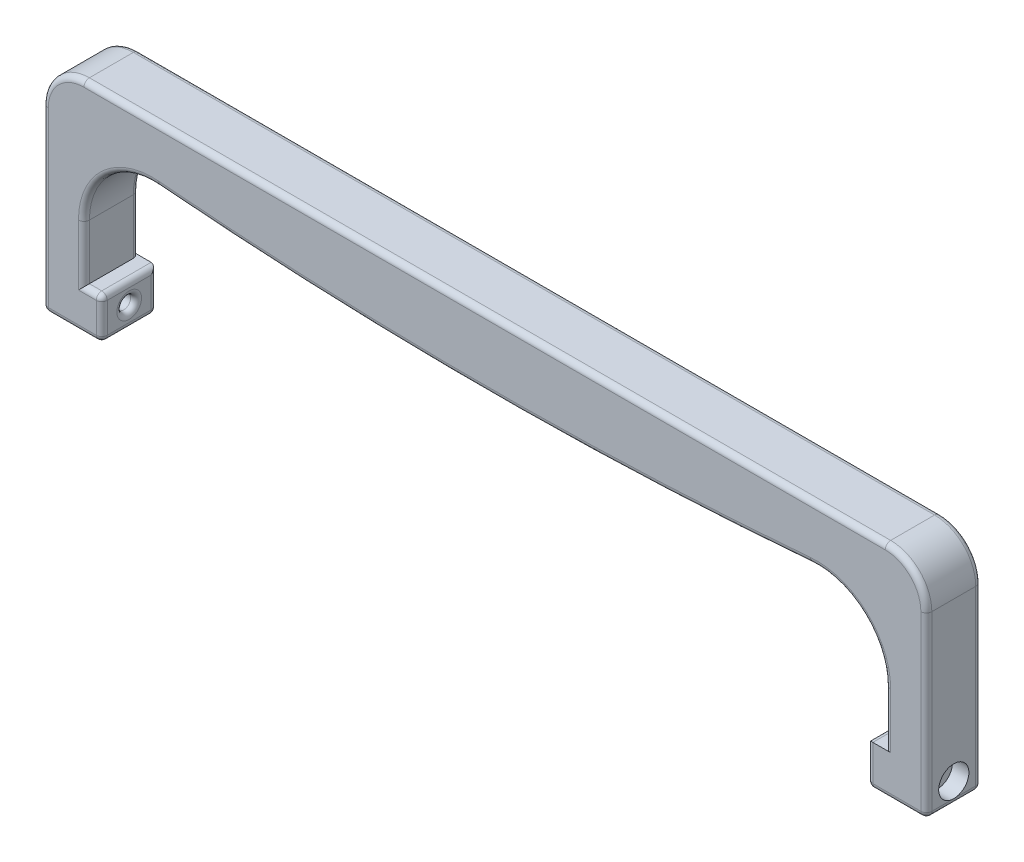
from build123d import *

# Parameters (mm, degrees)
BOSS_EXTRUDE1_DEPTH      = 20
FILLET7_R                = 15
CUT_EXTRUDE3_DEPTH       = 333.39133562714903
CUT_EXTRUDE3_DEPTH_BACK  = 333.39133562714903
SKETCH5_R                = 2.5
SKETCH6_R                = 5.5
CUT_EXTRUDE4_DEPTH       = 6
CUT_EXTRUDE5_START       = -6
SKETCH7_R                = 5.5
CUT_EXTRUDE5_DEPTH       = 6
FILLET2_R                = 2
FILLET3_R                = 2
BOSS_EXTRUDE2_DEPTH      = 1
BOSS_EXTRUDE2_DEPTH_BACK = 10


with BuildPart() as part:
    # Sketch1 → Boss-Extrude1 (new body)
    with BuildSketch(Plane.XY):
        with BuildLine():
            Line((-146.00000000000003, 15), (-146.00000000000003, 35.088261394563546))
            ThreePointArc((-146.00000000000003, 35.088261394563546), (-137.91933959730483, 53.49304195807679), (-118.90112419271411, 60))
            ThreePointArc((-118.90112419271411, 60), (8.672e-14, 55), (118.90112419271411, 60))
            ThreePointArc((118.90112419271411, 60), (137.91933959730483, 53.493041958076795), (146.00000000000003, 35.088261394563546))
            Line((146.00000000000003, 35.088261394563546), (146.00000000000003, 14.999999999999998))
            Line((146.00000000000003, 14.999999999999998), (139.49999999999997, 15))
            Line((139.49999999999997, 15), (139.49999999999997, -8e-16))
            Line((139.49999999999997, -8e-16), (146.00000000000003, -1.788e-14))
            Line((146.00000000000003, -1.788e-14), (161.00000000000003, -1.223e-14))
            Line((161.00000000000003, -1.223e-14), (161.00000000000003, 28.577779898868368))
            Line((161.00000000000003, 28.577779898868368), (161.00000000000003, 80.00000000000001))
            Line((161.00000000000003, 80.00000000000001), (84.84499999999998, 80.00000000000001))
            Line((84.84499999999998, 80.00000000000001), (-146.00000000000003, 79.99999999999997))
            Line((-146.00000000000003, 79.99999999999997), (-161.00000000000003, 79.99999999999997))
            Line((-161.00000000000003, 79.99999999999997), (-161.00000000000003, 28.577779898868233))
            Line((-161.00000000000003, 28.577779898868233), (-161.00000000000003, -1.223e-14))
            Line((-161.00000000000003, -1.223e-14), (-146.00000000000003, -1.788e-14))
            Line((-146.00000000000003, -1.788e-14), (-139.49999999999997, -8e-16))
            Line((-139.49999999999997, -8e-16), (-139.49999999999997, 15))
            Line((-139.49999999999997, 15), (-146.00000000000003, 15))
        make_face()
    extrude(amount=BOSS_EXTRUDE1_DEPTH)

    # Fillet7
    fillet7_edges = [part.edges().sort_by_distance(p)[0] for p in [
        (161.00000000000003, 80.00000000000001, 10),
        (-161.00000000000003, 79.99999999999997, 10),
    ]]
    fillet(fillet7_edges, radius=FILLET7_R)

    # Sketch5 → Cut-Extrude3 (cut, two sides: drawn at the far end of the back side and taken through both)
    with BuildSketch(Plane.ZY.offset(161.00000000000003).offset(-CUT_EXTRUDE3_DEPTH_BACK)):
        with Locations((10, 7.499999999999994)):
            Circle(SKETCH5_R)
    extrude(amount=CUT_EXTRUDE3_DEPTH + CUT_EXTRUDE3_DEPTH_BACK, mode=Mode.SUBTRACT)

    # Sketch6 → Cut-Extrude4 (cut)
    with BuildSketch(Plane.ZY.offset(161.00000000000003)):
        with Locations((10, 7.499999999999994)):
            Circle(SKETCH6_R)
    extrude(amount=-CUT_EXTRUDE4_DEPTH, mode=Mode.SUBTRACT)

    # Sketch7 → Cut-Extrude5 (cut)
    with BuildSketch(Plane(origin=(161.00000000000003, 0, 0), x_dir=(0, 0, -1), z_dir=(1, 0, 0)).offset(CUT_EXTRUDE5_START)):
        with Locations((-10, 7.499999999999994)):
            Circle(SKETCH7_R)
    extrude(amount=CUT_EXTRUDE5_DEPTH, mode=Mode.SUBTRACT)

    # Fillet2
    fillet2_edges = [part.edges().sort_by_distance(p)[0] for p in [
        (146.00000000000003, 25.044130697281773, 20),
        (137.91933959730483, 53.49304195807679, 20),
        (3.55e-15, 55, 20),
        (-137.91933959730483, 53.49304195807679, 20),
        (146.00000000000003, 25.044130697281773, 0),
        (137.91933959730483, 53.49304195807679, 0),
        (3.55e-15, 55, 0),
        (-137.91933959730483, 53.49304195807679, 0),
        (161.00000000000003, 32.5, 20),
        (161.00000000000003, 32.5, 0),
        (-146.00000000000003, 25.044130697281773, 20),
        (-146.00000000000003, 25.044130697281773, 0),
        (-161.00000000000003, 32.5, 0),
        (-161.00000000000003, 32.5, 20),
        (156.60660171779824, 75.60660171779823, 0),
        (0, 80, 0),
        (-156.60660171779824, 75.60660171779823, 0),
        (156.60660171779824, 75.60660171779823, 20),
        (0, 80, 20),
        (-156.60660171779824, 75.60660171779823, 20),
    ]]
    fillet(fillet2_edges, radius=FILLET2_R)

    # Fillet3
    fillet3_edges = [part.edges().sort_by_distance(p)[0] for p in [
        (149.25, -5.98e-15, 0),
        (160.41421356237313, -5.205e-14, 0.5857864376269046),
        (161.00000000000003, -1.223e-14, 10),
        (160.41421356237313, -4.263e-14, 19.414213562373096),
        (-149.25, -5.98e-15, 0),
        (-160.41421356237313, -1.421e-14, 0.5857864376269049),
        (-161.00000000000003, -1.223e-14, 10),
        (-160.41421356237313, -1.298e-14, 19.414213562373096),
        (139.49999999999997, 15, 10),
        (139.49999999999997, 7.5, 20),
        (139.49999999999997, -8e-16, 10),
        (139.49999999999997, 7.5, 0),
        (139.49999999999997, 7.499999999999994, 7.5),
        (-139.49999999999997, -8e-16, 10),
        (-139.49999999999997, 7.499999999999999, 20),
        (-139.49999999999997, 15, 10),
        (-139.49999999999997, 7.499999999999999, 0),
        (-139.49999999999997, 7.499999999999994, 7.5),
        (143.75, 14.999999999999996, -2.2e-16),
        (149.25, -5.98e-15, 20),
        (-149.25, -5.98e-15, 20),
        (-143.75, 15, 20),
    ]]
    fillet(fillet3_edges, radius=FILLET3_R)

    # Sketch8 → Boss-Extrude2 (add, two sides: drawn at the far end of the back side and taken through both)
    # profile 1 of 9: a face of its own
    with BuildSketch(Plane(origin=(1e-17, 1e-17, -0.200000000000006), x_dir=(-1, 0, -5e-17), z_dir=(5e-17, 4e-17, -1)).offset(-BOSS_EXTRUDE2_DEPTH_BACK)):
        with BuildLine():
            Line((-30.517022519889416, 73.74602396791785), (-31.881612061563306, 72.17358700414518))
            Line((-31.881612061563306, 72.17358700414518), (-33.036250841802335, 70.84974614655205))
            Line((-33.036250841802335, 70.84974614655205), (-34.08071072361279, 69.6561283548446))
            ThreePointArc((-34.08071072361279, 69.6561283548446), (-34.09167199181621, 69.64798574838517), (-34.10501822003159, 69.64509963802631))
            ThreePointArc((-34.10501822003159, 69.64509963802631), (-34.11872671725561, 69.64755721049654), (-34.13072778087494, 69.65462382429612))
            Line((-34.13072778087494, 69.65462382429612), (-35.06952265457502, 70.46082136022505))
            Line((-35.06952265457502, 70.46082136022505), (-36.10960574628801, 71.35727611334067))
            Line((-36.10960574628801, 71.35727611334067), (-37.338076283696616, 72.42202461248611))
            Line((-37.338076283696616, 72.42202461248611), (-38.5665683359056, 73.48775835033963))
            Line((-38.5665683359056, 73.48775835033963), (-39.60682239535434, 74.38734433646418))
            Line((-39.60682239535434, 74.38734433646418), (-40.544864829487096, 75.1968540615666))
            ThreePointArc((-40.544864829487096, 75.1968540615666), (-40.55762979171378, 75.20607437847566), (-40.57178971911695, 75.21296313456725))
            ThreePointArc((-40.57178971911695, 75.21296313456725), (-40.58296829963571, 75.21386586393531), (-40.592857953609936, 75.20857716589173))
            ThreePointArc((-40.592857953609936, 75.20857716589173), (-40.606947440180576, 75.19315015471757), (-40.61929940246347, 75.17629977391019))
            ThreePointArc((-40.61929940246347, 75.17629977391019), (-40.63614179688674, 75.1484867485354), (-40.65103916527198, 75.11958520799512))
            Line((-40.65103916527198, 75.11958520799512), (-40.69021223809995, 75.03172925296559))
            Line((-40.69021223809995, 75.03172925296559), (-42.278492497513106, 71.24151479320118))
            Line((-42.278492497513106, 71.24151479320118), (-44.770546020938646, 65.28659821768929))
            Line((-44.770546020938646, 65.28659821768929), (-47.60344758237721, 58.51521112987346))
            ThreePointArc((-47.60344758237721, 58.51521112987346), (-47.612762094503886, 58.49097474351078), (-47.620640209230714, 58.46623413178775))
            ThreePointArc((-47.620640209230714, 58.46623413178775), (-47.622682953143745, 58.45735232131227), (-47.62377639278466, 58.44830446246234))
            ThreePointArc((-47.62377639278466, 58.44830446246234), (-47.62361241781412, 58.44065800603708), (-47.6220999777339, 58.433160825990015))
            ThreePointArc((-47.6220999777339, 58.433160825990015), (-47.61972282359854, 58.427778100172624), (-47.616060205956, 58.423172686943275))
            ThreePointArc((-47.616060205956, 58.423172686943275), (-47.611784824398065, 58.42038253933098), (-47.60677408093159, 58.41940465330618))
            ThreePointArc((-47.60677408093159, 58.41940465330618), (-47.59660378079961, 58.42160996975596), (-47.588260372863886, 58.42782977436996))
            Line((-47.588260372863886, 58.42782977436996), (-46.540995921960246, 59.62994667204537))
            Line((-46.540995921960246, 59.62994667204537), (-45.384897881652215, 60.960250184986876))
            Line((-45.384897881652215, 60.960250184986876), (-44.016900277853416, 62.540398759677835))
            Line((-44.016900277853416, 62.540398759677835), (-42.64929269670946, 64.12055755657687))
            Line((-42.64929269670946, 64.12055755657687), (-41.494434005239654, 65.45085084731224))
            Line((-41.494434005239654, 65.45085084731224), (-40.447338078705364, 66.6546670558046))
            ThreePointArc((-40.447338078705364, 66.6546670558046), (-40.4406855672402, 66.65963221191005), (-40.432573306094135, 66.66139286606227))
            ThreePointArc((-40.432573306094135, 66.66139286606227), (-40.42423280221929, 66.65988919736115), (-40.41694252076583, 66.65556752861187))
            Line((-40.41694252076583, 66.65556752861187), (-39.47078316174019, 65.83657940119984))
            Line((-39.47078316174019, 65.83657940119984), (-38.425880058986, 64.9301596561797))
            Line((-38.425880058986, 64.9301596561797), (-37.188912138769126, 63.85351727229109))
            Line((-37.188912138769126, 63.85351727229109), (-35.60063238779016, 62.47196799344987))
            Line((-35.60063238779016, 62.47196799344987), (-34.66066261288131, 61.662692067863716))
            Line((-34.66066261288131, 61.662692067863716), (-33.97174080184667, 61.07533657193179))
            ThreePointArc((-33.97174080184667, 61.07533657193179), (-33.954050801530904, 61.06936025676506), (-33.93710325766889, 61.077198190879926))
            ThreePointArc((-33.93710325766889, 61.077198190879926), (-33.918071543720195, 61.101328397601385), (-33.9036837807438, 61.1284847097365))
            Line((-33.9036837807438, 61.1284847097365), (-30.41571960064513, 69.44990128602949))
            Line((-30.41571960064513, 69.44990128602949), (-26.926800706983364, 77.77378339228738))
            ThreePointArc((-26.926800706983364, 77.77378339228738), (-26.91857896521943, 77.80058280495462), (-26.915802041310265, 77.82847714578826))
            ThreePointArc((-26.915802041310265, 77.82847714578826), (-26.91628310524661, 77.83212386207289), (-26.917693390287262, 77.83552107538318))
            ThreePointArc((-26.917693390287262, 77.83552107538318), (-26.920050789000157, 77.83878922391445), (-26.92301185429802, 77.84152239346932))
            ThreePointArc((-26.92301185429802, 77.84152239346932), (-26.926812118481564, 77.84389103801517), (-26.93096767425751, 77.84555952266966))
            ThreePointArc((-26.93096767425751, 77.84555952266966), (-26.935605763254234, 77.84659921986893), (-26.940346120254198, 77.84694829768345))
            ThreePointArc((-26.940346120254198, 77.84694829768345), (-26.949504077333067, 77.84496389925708), (-26.95701921565091, 77.8393666936117))
            Line((-26.95701921565091, 77.8393666936117), (-28.001119251599146, 76.6423017891643))
            Line((-28.001119251599146, 76.6423017891643), (-29.153229052668816, 75.31848177739387))
            ThreePointArc((-29.153229052668816, 75.31848177739387), (-29.83537737952861, 74.53247107961056), (-30.517022519889416, 73.74602396791785))
        make_face()
    # profile 2 of 9: a face of its own
    with BuildSketch(Plane(origin=(1e-17, 1e-17, -0.200000000000006), x_dir=(-1, 0, -5e-17), z_dir=(5e-17, 4e-17, -1)).offset(-BOSS_EXTRUDE2_DEPTH_BACK)):
        with BuildLine():
            Line((-25.194575700847825, 71.801086874867), (-25.227873841661587, 70.31216477346783))
            Line((-25.227873841661587, 70.31216477346783), (-26.529654081214108, 67.24914457303491))
            Line((-26.529654081214108, 67.24914457303491), (-27.029758257584028, 66.07227059445927))
            Line((-27.029758257584028, 66.07227059445927), (-27.453071642457253, 65.07575829175823))
            Line((-27.453071642457253, 65.07575829175823), (-27.833703249137812, 64.17951483325015))
            Line((-27.833703249137812, 64.17951483325015), (-27.845171440542106, 64.15164519234153))
            ThreePointArc((-27.845171440542106, 64.15164519234153), (-27.843842865329282, 64.13850452208453), (-27.83231738953594, 64.13205427134237))
            Line((-27.83231738953594, 64.13205427134237), (-27.614904594399732, 64.12546089649939))
            Line((-27.614904594399732, 64.12546089649939), (-27.278222587072563, 64.12212698550762))
            Line((-27.278222587072563, 64.12212698550762), (-26.63139418866299, 64.12488500095293))
            Line((-26.63139418866299, 64.12488500095293), (-25.403879775406466, 64.13260445246493))
            Line((-25.403879775406466, 64.13260445246493), (-25.250700631572183, 64.20782461001262))
            ThreePointArc((-25.250700631572183, 64.20782461001262), (-25.217687602892184, 64.22513663176431), (-25.18563829634145, 64.24417365120999))
            ThreePointArc((-25.18563829634145, 64.24417365120999), (-25.150757396494733, 64.26709676174967), (-25.116768269595287, 64.29132247997522))
            ThreePointArc((-25.116768269595287, 64.29132247997522), (-25.08508546399332, 64.3157754121767), (-25.054363065733263, 64.34142458973103))
            ThreePointArc((-25.054363065733263, 64.34142458973103), (-25.03125292833814, 64.36308417965613), (-25.0098633136667, 64.38644441660595))
            ThreePointArc((-25.0098633136667, 64.38644441660595), (-24.972694312373054, 64.43701386235885), (-24.942874437247095, 64.4922368516694))
            Line((-24.942874437247095, 64.4922368516694), (-24.735598075363207, 64.949285141681))
            Line((-24.735598075363207, 64.949285141681), (-24.45395761738369, 65.58842290877762))
            Line((-24.45395761738369, 65.58842290877762), (-24.039131152275203, 66.55165558837808))
            Line((-24.039131152275203, 66.55165558837808), (-23.699391394080635, 67.34228578177328))
            Line((-23.699391394080635, 67.34228578177328), (-23.410821404231918, 68.00801450417856))
            Line((-23.410821404231918, 68.00801450417856), (-23.149294715694623, 68.60795760336822))
            ThreePointArc((-23.149294715694623, 68.60795760336822), (-23.145665954596673, 68.61235309826671), (-23.1402603727056, 68.61416085016549))
            ThreePointArc((-23.1402603727056, 68.61416085016549), (-23.134825906736065, 68.61276351696985), (-23.13109127866276, 68.60857561611289))
            Line((-23.13109127866276, 68.60857561611289), (-22.835810827794738, 67.96947552926136))
            Line((-22.835810827794738, 67.96947552926136), (-22.51000192961861, 67.26063315383296))
            Line((-22.51000192961861, 67.26063315383296), (-22.126024477118758, 66.41851579526681))
            Line((-22.126024477118758, 66.41851579526681), (-21.620113231339946, 65.31020172525088))
            Line((-21.620113231339946, 65.31020172525088), (-21.322786771247664, 64.67373479049049))
            Line((-21.322786771247664, 64.67373479049049), (-21.113851379945263, 64.23946384284635))
            ThreePointArc((-21.113851379945263, 64.23946384284635), (-21.090737801675647, 64.20472919457747), (-21.059220458224615, 64.17739075364574))
            ThreePointArc((-21.059220458224615, 64.17739075364574), (-21.023863025121436, 64.15991566791031), (-20.985349444572286, 64.15141679678581))
            ThreePointArc((-20.985349444572286, 64.15141679678581), (-20.899319004140487, 64.14440046209126), (-20.813117740797388, 64.13994986308782))
            ThreePointArc((-20.813117740797388, 64.13994986308782), (-20.663197965565555, 64.13568148221127), (-20.51322826317889, 64.13387969228837))
            Line((-20.51322826317889, 64.13387969228837), (-19.83902123766232, 64.13260271930952))
            Line((-19.83902123766232, 64.13260271930952), (-18.68719075434874, 64.13260271930952))
            Line((-18.68719075434874, 64.13260271930952), (-18.51744561560239, 64.22463094003348))
            ThreePointArc((-18.51744561560239, 64.22463094003348), (-18.482303458034874, 64.24457805871911), (-18.44796420994451, 64.26587770244728))
            ThreePointArc((-18.44796420994451, 64.26587770244728), (-18.413338940044188, 64.28917796037776), (-18.37955841050873, 64.31368688037846))
            ThreePointArc((-18.37955841050873, 64.31368688037846), (-18.3500671019475, 64.33673289062989), (-18.321424429720146, 64.36082548693747))
            ThreePointArc((-18.321424429720146, 64.36082548693747), (-18.302919484645656, 64.37877258063936), (-18.286407887883147, 64.3985690029653))
            ThreePointArc((-18.286407887883147, 64.3985690029653), (-18.252048135692686, 64.45071184470648), (-18.224151107950142, 64.5065797635738))
            Line((-18.224151107950142, 64.5065797635738), (-16.713731049154497, 68.04589805331781))
            Line((-16.713731049154497, 68.04589805331781), (-15.222493403982378, 71.54198383737773))
            ThreePointArc((-15.222493403982378, 71.54198383737773), (-15.181801611077226, 71.64674736599228), (-15.148018691453188, 71.75393847233644))
            ThreePointArc((-15.148018691453188, 71.75393847233644), (-15.151158888249334, 71.7734864005924), (-15.168063420864131, 71.783792666264))
            ThreePointArc((-15.168063420864131, 71.783792666264), (-15.238167294449251, 71.79047082211542), (-15.308486134481148, 71.79426708261528))
            ThreePointArc((-15.308486134481148, 71.79426708261528), (-15.449595441491912, 71.79761169652794), (-15.590743095009977, 71.79821408645769))
            Line((-15.590743095009977, 71.79821408645769), (-16.34889072420355, 71.79408421360422))
            Line((-16.34889072420355, 71.79408421360422), (-17.56328330351177, 71.78588367616983))
            Line((-17.56328330351177, 71.78588367616983), (-17.695506951477714, 71.72032302176873))
            ThreePointArc((-17.695506951477714, 71.72032302176873), (-17.802334592565398, 71.65585034668128), (-17.89708974002304, 71.57466948216523))
            ThreePointArc((-17.89708974002304, 71.57466948216523), (-17.981687678970637, 71.47563359681875), (-18.051028752355027, 71.3653760192903))
            ThreePointArc((-18.051028752355027, 71.3653760192903), (-18.15301148573282, 71.16310087263345), (-18.246144045493562, 70.95660138310706))
            Line((-18.246144045493562, 70.95660138310706), (-18.80587480530798, 69.63171799428814))
            Line((-18.80587480530798, 69.63171799428814), (-19.098449411319155, 68.93682470223517))
            Line((-19.098449411319155, 68.93682470223517), (-19.349111607329487, 68.34620701131271))
            Line((-19.349111607329487, 68.34620701131271), (-19.573236313915658, 67.82104320358061))
            ThreePointArc((-19.573236313915658, 67.82104320358061), (-19.580906661893607, 67.80594189575936), (-19.590508015688652, 67.79198848250965))
            ThreePointArc((-19.590508015688652, 67.79198848250965), (-19.597563453819166, 67.78475721913398), (-19.60596045912192, 67.77913932992473))
            ThreePointArc((-19.60596045912192, 67.77913932992473), (-19.61842512099299, 67.77321753446356), (-19.631343535002443, 67.76836469647692))
            ThreePointArc((-19.631343535002443, 67.76836469647692), (-19.646310856300243, 67.76409369402741), (-19.661567253654688, 67.76101075573439))
            ThreePointArc((-19.661567253654688, 67.76101075573439), (-19.676924496648894, 67.75915782715414), (-19.692380729379, 67.75853885502275))
            ThreePointArc((-19.692380729379, 67.75853885502275), (-19.707631947234653, 67.75915813035074), (-19.72278274792565, 67.76101187964183))
            ThreePointArc((-19.72278274792565, 67.76101187964183), (-19.737441351992313, 67.76406456497033), (-19.751783681995633, 67.76836469647692))
            ThreePointArc((-19.751783681995633, 67.76836469647692), (-19.763833163830295, 67.77319631286137), (-19.77537508878884, 67.77913924964562))
            ThreePointArc((-19.77537508878884, 67.77913924964562), (-19.7828236579285, 67.7847441273493), (-19.78869010102561, 67.79198848250968))
            ThreePointArc((-19.78869010102561, 67.79198848250968), (-19.796630266415477, 67.80567672714416), (-19.80366361759115, 67.81985227788589))
            Line((-19.80366361759115, 67.81985227788589), (-20.05978520350341, 68.38121592626077))
            Line((-20.05978520350341, 68.38121592626077), (-20.346168765141424, 69.01029763818704))
            Line((-20.346168765141424, 69.01029763818704), (-20.682237627416974, 69.75089735754851))
            Line((-20.682237627416974, 69.75089735754851), (-21.12514652658429, 70.72349435402307))
            Line((-21.12514652658429, 70.72349435402307), (-21.38734841592241, 71.28423668409354))
            Line((-21.38734841592241, 71.28423668409354), (-21.570183945967244, 71.66127414168082))
            ThreePointArc((-21.570183945967244, 71.66127414168082), (-21.595062868386215, 71.69963456532909), (-21.628220762277998, 71.73111530477189))
            ThreePointArc((-21.628220762277998, 71.73111530477189), (-21.66998415002099, 71.75429229930907), (-21.716412578326246, 71.76550633857477))
            ThreePointArc((-21.716412578326246, 71.76550633857477), (-21.819651831155575, 71.77432283065916), (-21.923130901559073, 71.77962903889673))
            ThreePointArc((-21.923130901559073, 71.77962903889673), (-22.124276987158, 71.78506234589283), (-22.325480700731596, 71.787579133703))
            Line((-22.325480700731596, 71.787579133703), (-23.44805911531989, 71.79348329286458))
            Line((-23.44805911531989, 71.79348329286458), (-25.194575700847825, 71.801086874867))
        make_face()
    # profile 3 of 9: a face of its own
    with BuildSketch(Plane(origin=(1e-17, 1e-17, -0.200000000000006), x_dir=(-1, 0, -5e-17), z_dir=(5e-17, 4e-17, -1)).offset(-BOSS_EXTRUDE2_DEPTH_BACK)):
        with BuildLine():
            Line((13.591695963639955, 71.77919749215903), (12.447718703588956, 71.77192524878659))
            Line((12.447718703588956, 71.77192524878659), (12.447718703588956, 70.75053054422978))
            Line((12.447718703588956, 70.75053054422978), (11.972733993274915, 70.26115082686665))
            Line((11.972733993274915, 70.26115082686665), (11.660281424315405, 69.94210538984893))
            Line((11.660281424315405, 69.94210538984893), (10.807976165527528, 69.08017284659554))
            Line((10.807976165527528, 69.08017284659554), (9.790523593228734, 68.05288065159617))
            Line((9.790523593228734, 68.05288065159617), (8.674600723068465, 66.92801431439536))
            Line((8.674600723068465, 66.92801431439536), (5.851452163175836, 64.08425749252741))
            Line((5.851452163175836, 64.08425749252741), (7.400482950812076, 64.10210717710366))
            Line((7.400482950812076, 64.10210717710366), (8.36695684579713, 64.11442838752798))
            ThreePointArc((8.36695684579713, 64.11442838752798), (8.55526748242397, 64.11841334201456), (8.7435014164332, 64.12510376924116))
            ThreePointArc((8.7435014164332, 64.12510376924116), (8.847707326239451, 64.13137977804593), (8.951630966070205, 64.14128619058498))
            ThreePointArc((8.951630966070205, 64.14128619058498), (9.012300957283168, 64.15285842478418), (9.070519291185743, 64.17348341049934))
            ThreePointArc((9.070519291185743, 64.17348341049934), (9.108676622407918, 64.19306853164028), (9.14432329854419, 64.21691959821055))
            ThreePointArc((9.14432329854419, 64.21691959821055), (9.19866630479621, 64.259312445817), (9.25170746721627, 64.30332325069284))
            ThreePointArc((9.25170746721627, 64.30332325069284), (9.320097967131854, 64.3633362942388), (9.386959109263472, 64.42504863941551))
            Line((9.386959109263472, 64.42504863941551), (9.554919536442602, 64.58789287917163))
            Line((9.554919536442602, 64.58789287917163), (9.918314228962938, 64.94877585254392))
            Line((9.918314228962938, 64.94877585254392), (14.288644106448695, 64.94877585254392))
            Line((14.288644106448695, 64.94877585254392), (14.319315836032182, 64.76814786411481))
            Line((14.319315836032182, 64.76814786411481), (14.333123494382422, 64.68680982321904))
            Line((14.333123494382422, 64.68680982321904), (14.349330989567028, 64.59129007685868))
            Line((14.349330989567028, 64.59129007685868), (14.3653259591987, 64.49698875324914))
            Line((14.3653259591987, 64.49698875324914), (14.37842419108914, 64.4197266431217))
            ThreePointArc((14.37842419108914, 64.4197266431217), (14.384964370107918, 64.38527716331966), (14.3928589898159, 64.35111262644446))
            ThreePointArc((14.3928589898159, 64.35111262644446), (14.402111766836992, 64.31721006116805), (14.412686510725907, 64.28369629374916))
            ThreePointArc((14.412686510725907, 64.28369629374916), (14.42308982225022, 64.25476125309966), (14.43463594220495, 64.22626296223774))
            ThreePointArc((14.43463594220495, 64.22626296223774), (14.443710759495143, 64.2085595506785), (14.455129511401678, 64.1922692101485))
            Line((14.455129511401678, 64.1922692101485), (14.503398207631019, 64.1326049418641))
            Line((14.503398207631019, 64.1326049418641), (15.951798841579375, 64.10904315806084))
            Line((15.951798841579375, 64.10904315806084), (16.508385068814576, 64.10126876888064))
            Line((16.508385068814576, 64.10126876888064), (16.979872152279583, 64.09754301557255))
            Line((16.979872152279583, 64.09754301557255), (17.400693780742934, 64.09597010704934))
            ThreePointArc((17.400693780742934, 64.09597010704934), (17.40989642937089, 64.09777667091026), (17.41769855371504, 64.10298044554716))
            ThreePointArc((17.41769855371504, 64.10298044554716), (17.42588420289553, 64.11646477561366), (17.426924000508325, 64.13220487824272))
            Line((17.426924000508325, 64.13220487824272), (16.759811494385712, 67.93083593167952))
            Line((16.759811494385712, 67.93083593167952), (16.096046880586467, 71.7092319690623))
            ThreePointArc((16.096046880586467, 71.7092319690623), (16.086078488718094, 71.74547002103996), (16.069478938621607, 71.77918975093465))
            ThreePointArc((16.069478938621607, 71.77918975093465), (16.063459353359256, 71.78502337591586), (16.05538379137816, 71.78727101597646))
            Line((16.05538379137816, 71.78727101597646), (15.86666290321936, 71.7914855473126))
            Line((15.86666290321936, 71.7914855473126), (15.650595756979687, 71.79387069307028))
            Line((15.650595756979687, 71.79387069307028), (15.396396570599208, 71.79286463531434))
            Line((15.396396570599208, 71.79286463531434), (15.064684294846082, 71.78991049801323))
            Line((15.064684294846082, 71.78991049801323), (14.593717393227784, 71.78621201284149))
            Line((14.593717393227784, 71.78621201284149), (14.078109661985744, 71.7824503747704))
            ThreePointArc((14.078109661985744, 71.7824503747704), (13.8349030811757, 71.78078380433453), (13.591695963639955, 71.77919749215903))
        make_face()
        Polygon((11.795917416419847, 66.76685170737503), (14.007034074707363, 66.78850536510332), (13.656683906898998, 68.70595567427992), align=None, mode=Mode.SUBTRACT)
    # profile 4 of 9: a face of its own
    with BuildSketch(Plane(origin=(1e-17, 1e-17, -0.200000000000006), x_dir=(-1, 0, -5e-17), z_dir=(5e-17, 4e-17, -1)).offset(-BOSS_EXTRUDE2_DEPTH_BACK)):
        with BuildLine():
            Line((-3.5813427881241693, 71.79925382188529), (-3.5813427881241693, 70.28774997064427))
            Line((-3.5813427881241693, 70.28774997064427), (-4.877979732675458, 67.25031699585685))
            Line((-4.877979732675458, 67.25031699585685), (-5.3763898861101165, 66.08233168045422))
            Line((-5.3763898861101165, 66.08233168045422), (-5.798977842222724, 65.09105614439339))
            Line((-5.798977842222724, 65.09105614439339), (-6.177187776152509, 64.2032870285901))
            Line((-6.177187776152509, 64.2032870285901), (-6.192483113375063, 64.16497310275473))
            ThreePointArc((-6.192483113375063, 64.16497310275473), (-6.190705649727166, 64.14603885998419), (-6.174757914932497, 64.13567861475386))
            ThreePointArc((-6.174757914932497, 64.13567861475386), (-6.1086070238087595, 64.1288432395458), (-6.042214702605358, 64.125006256887))
            ThreePointArc((-6.042214702605358, 64.125006256887), (-5.9071183408160834, 64.12162797848708), (-5.771981292733624, 64.12098147310789))
            Line((-5.771981292733624, 64.12098147310789), (-5.049714421784168, 64.12482726198917))
            Line((-5.049714421784168, 64.12482726198917), (-3.889079327523382, 64.13259865408278))
            Line((-3.889079327523382, 64.13259865408278), (-3.755280817576168, 64.2033940413871))
            ThreePointArc((-3.755280817576168, 64.2033940413871), (-3.699406400792971, 64.23470642769355), (-3.6451074048865815, 64.26867751879503))
            ThreePointArc((-3.6451074048865815, 64.26867751879503), (-3.5998197471671904, 64.3010000361789), (-3.557023912111799, 64.33655609858255))
            ThreePointArc((-3.557023912111799, 64.33655609858255), (-3.521239650676727, 64.37136341849381), (-3.4884723258194166, 64.40902460949403))
            ThreePointArc((-3.4884723258194166, 64.40902460949403), (-3.460868420746576, 64.44727453405157), (-3.4371631929456137, 64.48805558944294))
            Line((-3.4371631929456137, 64.48805558944294), (-3.409467918255349, 64.54584985581414))
            Line((-3.409467918255349, 64.54584985581414), (-3.318231303035424, 64.75281624148467))
            Line((-3.318231303035424, 64.75281624148467), (-3.2109203489080085, 64.99858497107138))
            Line((-3.2109203489080085, 64.99858497107138), (-3.0917134763003173, 65.27445352189017))
            Line((-3.0917134763003173, 65.27445352189017), (-2.9019840850691314, 65.72492864651582))
            ThreePointArc((-2.9019840850691314, 65.72492864651582), (-2.8491326953495983, 65.85951366505039), (-2.8008210119158, 65.995794176691))
            ThreePointArc((-2.8008210119158, 65.995794176691), (-2.755413170208824, 66.13831867144108), (-2.7144423262354724, 66.2821814311684))
            Line((-2.7144423262354724, 66.2821814311684), (-2.5766374607449394, 66.80856885303318))
            Line((-2.5766374607449394, 66.80856885303318), (-2.364693476147821, 67.63811961470786))
            Line((-2.364693476147821, 67.63811961470786), (-2.3424242929896466, 67.49094125376557))
            Line((-2.3424242929896466, 67.49094125376557), (-2.1758864650846577, 66.41743944202157))
            Line((-2.1758864650846577, 66.41743944202157), (-2.001020215129883, 65.34320759884763))
            Line((-2.001020215129883, 65.34320759884763), (-1.8276570041161944, 64.30618731558566))
            ThreePointArc((-1.8276570041161944, 64.30618731558566), (-1.8173951976639475, 64.26870925272512), (-1.7998187255780627, 64.23405413049973))
            ThreePointArc((-1.7998187255780627, 64.23405413049973), (-1.7604312330875496, 64.19188587537234), (-1.708668945591356, 64.16638681855957))
            ThreePointArc((-1.708668945591356, 64.16638681855957), (-1.6198551911607975, 64.14589197435788), (-1.5294378403657962, 64.13437571237247))
            ThreePointArc((-1.5294378403657962, 64.13437571237247), (-1.3619581090792952, 64.12473068515978), (-1.1942321657957804, 64.12149110318245))
            Line((-1.1942321657957804, 64.12149110318245), (-0.37017851590375916, 64.12428329076717))
            Line((-0.37017851590375916, 64.12428329076717), (0.41207915545210905, 64.13086154802808))
            ThreePointArc((0.41207915545210905, 64.13086154802808), (0.5477746530905232, 64.13366340445361), (0.6833778716831017, 64.13939800000159))
            ThreePointArc((0.6833778716831017, 64.13939800000159), (0.7582992716286386, 64.14583260846304), (0.8326422316747322, 64.15713502623252))
            ThreePointArc((0.8326422316747322, 64.15713502623252), (0.8881703384418675, 64.17163308361359), (0.9410468815816485, 64.19394082878323))
            ThreePointArc((0.9410468815816485, 64.19394082878323), (0.9925005222128965, 64.22495352611288), (1.0390259901679963, 64.26296201676207))
            Line((1.0390259901679963, 64.26296201676207), (1.389463402710478, 64.5935531442508))
            Line((1.389463402710478, 64.5935531442508), (1.8582262682340311, 65.04591076039196))
            Line((1.8582262682340311, 65.04591076039196), (2.5198721023482418, 65.69653432677647))
            Line((2.5198721023482418, 65.69653432677647), (3.0795188634599957, 66.2487913961835))
            Line((3.0795188634599957, 66.2487913961835), (3.5515926801505615, 66.7128167240667))
            Line((3.5515926801505615, 66.7128167240667), (3.9793880742699743, 67.13226828254759))
            ThreePointArc((3.9793880742699743, 67.13226828254759), (3.9817522029285493, 67.13325188649087), (3.9841411325376113, 67.13233015097865))
            ThreePointArc((3.9841411325376113, 67.13233015097865), (3.985534002563709, 67.12987901713493), (3.985273983430293, 67.127071788238))
            Line((3.985273983430293, 67.127071788238), (3.822937262517812, 66.73978512496925))
            Line((3.822937262517812, 66.73978512496925), (3.6425371597108573, 66.31143679512768))
            Line((3.6425371597108573, 66.31143679512768), (3.4271256261699805, 65.80367174423355))
            Line((3.4271256261699805, 65.80367174423355), (3.2103453338723225, 65.29051838650655))
            Line((3.2103453338723225, 65.29051838650655), (3.025321770034673, 64.8446927333418))
            Line((3.025321770034673, 64.8446927333418), (2.8673039636462065, 64.45838376152723))
            ThreePointArc((2.8673039636462065, 64.45838376152723), (2.856866473628086, 64.42825000603301), (2.849710984891495, 64.39717295020392))
            ThreePointArc((2.849710984891495, 64.39717295020392), (2.8459737771429934, 64.36029155741308), (2.847549657280831, 64.32325481271623))
            ThreePointArc((2.847549657280831, 64.32325481271623), (2.854536894716425, 64.28994482065688), (2.867531367593875, 64.25848817219249))
            ThreePointArc((2.867531367593875, 64.25848817219249), (2.886447157435822, 64.22921594644924), (2.910271107300992, 64.20377798823459))
            ThreePointArc((2.910271107300992, 64.20377798823459), (2.941141305510164, 64.17953024661185), (2.9748081495817034, 64.15934446643027))
            ThreePointArc((2.9748081495817034, 64.15934446643027), (3.013686618384881, 64.14397825341793), (3.05485540949222, 64.13671282310851))
            ThreePointArc((3.05485540949222, 64.13671282310851), (3.1490113049177655, 64.13084194852084), (3.2432776963198027, 64.12714772819061))
            ThreePointArc((3.2432776963198027, 64.12714772819061), (3.400427041011167, 64.12396335287512), (3.557606227428047, 64.123091492563))
            Line((3.557606227428047, 64.123091492563), (4.195740639497882, 64.12561784926824))
            Line((4.195740639497882, 64.12561784926824), (5.3379594124926895, 64.13259568239926))
            Line((5.3379594124926895, 64.13259568239926), (6.966141946612471, 67.95427401244514))
            Line((6.966141946612471, 67.95427401244514), (7.590452564231833, 69.42059334424083))
            Line((7.590452564231833, 69.42059334424083), (8.116045838421716, 70.65715205509498))
            Line((8.116045838421716, 70.65715205509498), (8.592238508442907, 71.77869836958955))
            ThreePointArc((8.592238508442907, 71.77869836958955), (8.593797679219595, 71.78371855670423), (8.594324453972769, 71.78894883399484))
            ThreePointArc((8.594324453972769, 71.78894883399484), (8.592776350671636, 71.79269634586389), (8.589034740213258, 71.7942586583222))
            Line((8.589034740213258, 71.7942586583222), (8.191465489548227, 71.79576664419359))
            Line((8.191465489548227, 71.79576664419359), (7.748767456832544, 71.7960559700915))
            Line((7.748767456832544, 71.7960559700915), (7.222889727011166, 71.79390791529342))
            Line((7.222889727011166, 71.79390791529342), (5.851455000048727, 71.78587045148296))
            Line((5.851455000048727, 71.78587045148296), (5.717656490101069, 71.72164125281408))
            ThreePointArc((5.717656490101069, 71.72164125281408), (5.650411941379322, 71.68248698334438), (5.590236810554121, 71.63315302160738))
            Line((5.590236810554121, 71.63315302160738), (5.118193951781562, 71.17867414883592))
            Line((5.118193951781562, 71.17867414883592), (4.407638634309567, 70.48049123309801))
            Line((4.407638634309567, 70.48049123309801), (3.128651934276886, 69.20657220514913))
            Line((3.128651934276886, 69.20657220514913), (2.1871517452508296, 68.26867215938996))
            Line((2.1871517452508296, 68.26867215938996), (1.3946650440109487, 67.48355312661967))
            Line((1.3946650440109487, 67.48355312661967), (0.6812469468600846, 66.77932524772166))
            ThreePointArc((0.6812469468600846, 66.77932524772166), (0.6762628656051495, 66.7783593535333), (0.6734492767393898, 66.78258519489725))
            ThreePointArc((0.6734492767393898, 66.78258519489725), (0.6729909398807197, 66.79334769261679), (0.6716192697935472, 66.80403225863563))
            Line((0.6716192697935472, 66.80403225863563), (0.5984228868900628, 67.22983047713194))
            Line((0.5984228868900628, 67.22983047713194), (0.515960563875609, 67.70651022724871))
            Line((0.515960563875609, 67.70651022724871), (0.4180402581690642, 68.26740920861468))
            Line((0.4180402581690642, 68.26740920861468), (0.29118803166362806, 69.00887594232063))
            Line((0.29118803166362806, 69.00887594232063), (0.19606855692556902, 69.6063205951743))
            Line((0.19606855692556902, 69.6063205951743), (0.12125838477207462, 70.1319558285764))
            Line((0.12125838477207462, 70.1319558285764), (0.05741059213561239, 70.6485866363366))
            Line((0.05741059213561239, 70.6485866363366), (0.01596345307321189, 71.01053218395548))
            Line((0.01596345307321189, 71.01053218395548), (-0.0214974269820837, 71.33401132895706))
            Line((-0.0214974269820837, 71.33401132895706), (-0.05339560722682193, 71.60662258181083))
            Line((-0.05339560722682193, 71.60662258181083), (-0.0634558369107944, 71.6855250884299))
            Line((-0.0634558369107944, 71.6855250884299), (-0.07910167271039917, 71.79925382188529))
            Line((-0.07910167271039917, 71.79925382188529), (-3.5813427881241693, 71.79925382188529))
        make_face()
    # profile 5 of 9: a face of its own
    with BuildSketch(Plane(origin=(1e-17, 1e-17, -0.200000000000006), x_dir=(-1, 0, -5e-17), z_dir=(5e-17, 4e-17, -1)).offset(-BOSS_EXTRUDE2_DEPTH_BACK)):
        with BuildLine():
            Line((20.510708357275607, 71.77371526642256), (20.479991189718515, 70.25525294267914))
            Line((20.479991189718515, 70.25525294267914), (19.18976196284879, 67.22068876850533))
            Line((19.18976196284879, 67.22068876850533), (18.69414945597699, 66.05382703946754))
            Line((18.69414945597699, 66.05382703946754), (18.27469225119923, 65.0635782999324))
            Line((18.27469225119923, 65.0635782999324), (17.899473757594894, 64.1761347694229))
            ThreePointArc((17.899473757594894, 64.1761347694229), (17.89234388264127, 64.15759921427897), (17.886442291160296, 64.1386368004205))
            ThreePointArc((17.886442291160296, 64.1386368004205), (17.890604775896996, 64.11664096070149), (17.91054579772999, 64.10646752016333))
            Line((17.91054579772999, 64.10646752016333), (18.383931852992582, 64.09901142745957))
            Line((18.383931852992582, 64.09901142745957), (19.194480202408435, 64.0950496000607))
            Line((19.194480202408435, 64.0950496000607), (21.45575516582898, 64.09902989165391))
            Line((21.45575516582898, 64.09902989165391), (25.038158489650183, 64.10691110556452))
            Line((25.038158489650183, 64.10691110556452), (25.310852429982987, 64.17916883030347))
            ThreePointArc((25.310852429982987, 64.17916883030347), (25.692255155461492, 64.29940635969623), (26.060885666808076, 64.45444393121122))
            ThreePointArc((26.060885666808076, 64.45444393121122), (26.413020947041364, 64.64274472859677), (26.746117689573786, 64.86297870870725))
            ThreePointArc((26.746117689573786, 64.86297870870725), (27.039204686250905, 65.09993916537923), (27.307624035895802, 65.3645167501887))
            ThreePointArc((27.307624035895802, 65.3645167501887), (27.51750101985575, 65.62706608602602), (27.68920927807672, 65.9160241733042))
            ThreePointArc((27.68920927807672, 65.9160241733042), (27.77234122721372, 66.08802040058406), (27.849633639003184, 66.26271872984222))
            Line((27.849633639003184, 66.26271872984222), (28.584835976158573, 68.00308129072879))
            Line((28.584835976158573, 68.00308129072879), (29.34003838461663, 69.79639880213627))
            ThreePointArc((29.34003838461663, 69.79639880213627), (29.384292789542744, 69.91023493250921), (29.42225328742698, 70.0263216136317))
            ThreePointArc((29.42225328742698, 70.0263216136317), (29.46384845397432, 70.20428426712039), (29.484179786980157, 70.38590888223366))
            ThreePointArc((29.484179786980157, 70.38590888223366), (29.48092113582129, 70.55736525069857), (29.45328961794948, 70.72661182914152))
            ThreePointArc((29.45328961794948, 70.72661182914152), (29.402439612322183, 70.88748715668733), (29.3287583745879, 71.03926880673505))
            ThreePointArc((29.3287583745879, 71.03926880673505), (29.23128286413092, 71.18486706303413), (29.115722487110457, 71.3165717578596))
            ThreePointArc((29.115722487110457, 71.3165717578596), (29.048679296921435, 71.37927533785384), (28.977587433656943, 71.4373483545862))
            ThreePointArc((28.977587433656943, 71.4373483545862), (28.902538949535586, 71.4907284524602), (28.82411567248163, 71.539014055222))
            ThreePointArc((28.82411567248163, 71.539014055222), (28.738384772836426, 71.58446225125176), (28.649982852438328, 71.62446757772544))
            ThreePointArc((28.649982852438328, 71.62446757772544), (28.55076275447259, 71.66295242992862), (28.449830088660274, 71.69669126010174))
            Line((28.449830088660274, 71.69669126010174), (28.249322732725922, 71.75847087967234))
            Line((28.249322732725922, 71.75847087967234), (20.510708357275607, 71.77371526642256))
        make_face()
        Polygon((21.91507554496841, 66.119024670763), (24.68993419649035, 66.11366227408712), (24.943005390434504, 66.21972896319012), (26.46329629055134, 69.61036860771182), (26.301327932501266, 69.77649508027042), (23.068589485554455, 69.79228191264417), (21.6090577561554, 66.32722513861208), (21.688858078061596, 66.14230563248555), align=None, mode=Mode.SUBTRACT)
    # profile 6 of 9: a face of its own
    with BuildSketch(Plane(origin=(1e-17, 1e-17, -0.200000000000006), x_dir=(-1, 0, -5e-17), z_dir=(5e-17, 4e-17, -1)).offset(-BOSS_EXTRUDE2_DEPTH_BACK)):
        with BuildLine():
            Line((31.112719083407733, 71.7159522942792), (31.010052356694292, 71.47174591010588))
            Line((31.010052356694292, 71.47174591010588), (30.891909530116997, 71.18911713605262))
            Line((30.891909530116997, 71.18911713605262), (30.756421064709546, 70.86266999222437))
            Line((30.756421064709546, 70.86266999222437), (30.618808467677724, 70.53051848272298))
            Line((30.618808467677724, 70.53051848272298), (30.49396683138128, 70.22994211034376))
            Line((30.49396683138128, 70.22994211034376), (30.388978057433565, 69.97776986435014))
            Line((30.388978057433565, 69.97776986435014), (30.352849088025156, 69.89239255347799))
            Line((30.352849088025156, 69.89239255347799), (30.298137619601427, 69.76504572740109))
            Line((30.298137619601427, 69.76504572740109), (33.08923688721221, 69.77890206164942))
            Line((33.08923688721221, 69.77890206164942), (33.5253723706117, 70.76901103526103))
            Line((33.5253723706117, 70.76901103526103), (33.69261817995261, 71.15005284141371))
            Line((33.69261817995261, 71.15005284141371), (33.833541594353136, 71.47417098133904))
            Line((33.833541594353136, 71.47417098133904), (33.95861430067581, 71.76372366772391))
            ThreePointArc((33.95861430067581, 71.76372366772391), (33.961055271357246, 71.77129378566876), (33.962013505340444, 71.77918978536482))
            ThreePointArc((33.962013505340444, 71.77918978536482), (33.959776080431276, 71.78495608956992), (33.95410359859199, 71.78742171001775))
            Line((33.95410359859199, 71.78742171001775), (33.549962423602004, 71.79336405552326))
            Line((33.549962423602004, 71.79336405552326), (33.09688400812741, 71.79781737836858))
            Line((33.09688400812741, 71.79781737836858), (32.5585763164529, 71.79925953898788))
            Line((32.5585763164529, 71.79925953898788), (31.69700286164037, 71.79815342670612))
            ThreePointArc((31.69700286164037, 71.79815342670612), (31.52933262262207, 71.79645689590326), (31.361707113914754, 71.79222888220507))
            ThreePointArc((31.361707113914754, 71.79222888220507), (31.267942718327756, 71.78804978242455), (31.174302698684183, 71.78166437124572))
            ThreePointArc((31.174302698684183, 71.78166437124572), (31.148374476120747, 71.77274411105418), (31.12995755136334, 71.75243006050624))
            ThreePointArc((31.12995755136334, 71.75243006050624), (31.120941637289235, 71.73437863835419), (31.112719083407733, 71.7159522942792))
        make_face()
    # profile 7 of 9: a face of its own
    with BuildSketch(Plane(origin=(1e-17, 1e-17, -0.200000000000006), x_dir=(-1, 0, -5e-17), z_dir=(5e-17, 4e-17, -1)).offset(-BOSS_EXTRUDE2_DEPTH_BACK)):
        with BuildLine():
            Line((30.027518251924732, 69.01625055494856), (30.00368895138061, 68.95604122547219))
            Line((30.00368895138061, 68.95604122547219), (29.984149819779258, 68.9083889664335))
            Line((29.984149819779258, 68.9083889664335), (29.694368685818425, 68.2257104079507))
            Line((29.694368685818425, 68.2257104079507), (29.367580944502865, 67.45632621374861))
            Line((29.367580944502865, 67.45632621374861), (28.984146285798705, 66.55435797191409))
            Line((28.984146285798705, 66.55435797191409), (28.601453298994215, 65.65225673436085))
            Line((28.601453298994215, 65.65225673436085), (28.276958837380125, 64.88249177635916))
            Line((28.276958837380125, 64.88249177635916), (27.990069035700223, 64.19886022460943))
            ThreePointArc((27.990069035700223, 64.19886022460943), (27.981407232698757, 64.17523876395241), (27.9749354999887, 64.15092586798059))
            Line((27.9749354999887, 64.15092586798059), (27.961438081269826, 64.08896757471335))
            Line((27.961438081269826, 64.08896757471335), (30.36333918556133, 64.10584523987453))
            Line((30.36333918556133, 64.10584523987453), (30.527272170555396, 64.18160107313666))
            ThreePointArc((30.527272170555396, 64.18160107313666), (30.63979679771131, 64.24712549383736), (30.738019220442723, 64.33260997837995))
            ThreePointArc((30.738019220442723, 64.33260997837995), (30.830185925626818, 64.44404768213093), (30.906105792859684, 64.56712991935923))
            ThreePointArc((30.906105792859684, 64.56712991935923), (31.026718097453532, 64.80777045954977), (31.138143984565133, 65.05279998692154))
            Line((31.138143984565133, 65.05279998692154), (31.85088674537359, 66.70223606410542))
            Line((31.85088674537359, 66.70223606410542), (32.222429258715515, 67.56618064259185))
            Line((32.222429258715515, 67.56618064259185), (32.53746697544532, 68.29908424490122))
            Line((32.53746697544532, 68.29908424490122), (32.81970971403755, 68.95590530474738))
            Line((32.81970971403755, 68.95590530474738), (32.830893423050206, 68.98279698558713))
            ThreePointArc((32.830893423050206, 68.98279698558713), (32.82963477243351, 68.99552585210623), (32.81847016903171, 69.00176763671612))
            Line((32.81847016903171, 69.00176763671612), (32.555927533233216, 69.00946565926883))
            Line((32.555927533233216, 69.00946565926883), (32.162998451983995, 69.01490389970557))
            Line((32.162998451983995, 69.01490389970557), (31.43592792951399, 69.01625055494856))
            Line((31.43592792951399, 69.01625055494856), (30.027518251924732, 69.01625055494856))
        make_face()
    # profile 8 of 9: a face of its own
    with BuildSketch(Plane(origin=(1e-17, 1e-17, -0.200000000000006), x_dir=(-1, 0, -5e-17), z_dir=(5e-17, 4e-17, -1)).offset(-BOSS_EXTRUDE2_DEPTH_BACK)):
        with BuildLine():
            Line((34.0021039810312, 69.37175089454486), (33.40146965197976, 67.97262217735798))
            Line((33.40146965197976, 67.97262217735798), (33.068356264990044, 67.18677078506344))
            Line((33.068356264990044, 67.18677078506344), (32.78054183532708, 66.49858071807977))
            Line((32.78054183532708, 66.49858071807977), (32.53634539879057, 65.90793784627787))
            ThreePointArc((32.53634539879057, 65.90793784627787), (32.514730917752956, 65.85044137611035), (32.496752038083656, 65.7917064652133))
            ThreePointArc((32.496752038083656, 65.7917064652133), (32.47504830185244, 65.69602425665278), (32.461588879839624, 65.59883896372995))
            ThreePointArc((32.461588879839624, 65.59883896372995), (32.454335386555684, 65.48802794323296), (32.453635548531864, 65.37698198132915))
            ThreePointArc((32.453635548531864, 65.37698198132915), (32.45934272978936, 65.26972975834661), (32.471456412909376, 65.16301110986441))
            ThreePointArc((32.471456412909376, 65.16301110986441), (32.488615064293654, 65.07816159848586), (32.51524416958527, 64.99579200670667))
            ThreePointArc((32.51524416958527, 64.99579200670667), (32.59801534949242, 64.82341792902983), (32.706692791390154, 64.6660867353627))
            ThreePointArc((32.706692791390154, 64.6660867353627), (32.842536087690156, 64.52110320243352), (32.99727069547753, 64.39648046324375))
            ThreePointArc((32.99727069547753, 64.39648046324375), (33.17836231661119, 64.28716786016537), (33.37209352012804, 64.2022464775783))
            ThreePointArc((33.37209352012804, 64.2022464775783), (33.58846046657446, 64.13652481463619), (33.81058712198669, 64.09417222971152))
            ThreePointArc((33.81058712198669, 64.09417222971152), (33.89955697768084, 64.08484437324205), (33.988931573176096, 64.08099394357644))
            Line((33.988931573176096, 64.08099394357644), (34.653961875534634, 64.07277885585135))
            Line((34.653961875534634, 64.07277885585135), (35.52803419843301, 64.06691915010812))
            Line((35.52803419843301, 64.06691915010812), (36.700634893438256, 64.06481904869601))
            Line((36.700634893438256, 64.06481904869601), (39.38135871260976, 64.06393595177059))
            Line((39.38135871260976, 64.06393595177059), (40.16868852491954, 63.03330157703177))
            Line((40.16868852491954, 63.03330157703177), (40.47167230712881, 62.6374616824387))
            Line((40.47167230712881, 62.6374616824387), (40.72930834907454, 62.30259280547938))
            Line((40.72930834907454, 62.30259280547938), (40.96076459853241, 62.002791741945984))
            ThreePointArc((40.96076459853241, 62.002791741945984), (40.965728177647584, 61.99743688549653), (40.9715694436841, 61.993056107447195))
            ThreePointArc((40.9715694436841, 61.993056107447195), (40.98053649347215, 61.991949143612814), (40.98721673422964, 61.998032541861654))
            Line((40.98721673422964, 61.998032541861654), (41.52527159055372, 63.26578387372818))
            Line((41.52527159055372, 63.26578387372818), (42.03799178898468, 64.47598419784369))
            ThreePointArc((42.03799178898468, 64.47598419784369), (42.06680679129184, 64.55159964906083), (42.09009167105168, 64.62909684381847))
            ThreePointArc((42.09009167105168, 64.62909684381847), (42.09186669198935, 64.643775830758), (42.08964917261999, 64.65839451622375))
            ThreePointArc((42.08964917261999, 64.65839451622375), (42.08222116855398, 64.68058630686005), (42.07317223399605, 64.7021679564591))
            ThreePointArc((42.07317223399605, 64.7021679564591), (42.05967350071403, 64.72904967432203), (42.04451775778777, 64.75503324628268))
            ThreePointArc((42.04451775778777, 64.75503324628268), (42.02488282456014, 64.78514462287076), (42.004149575893486, 64.8145105555583))
            Line((42.004149575893486, 64.8145105555583), (41.90503155346158, 64.94953635427107))
            Line((41.90503155346158, 64.94953635427107), (42.18187798407024, 65.23945342751796))
            ThreePointArc((42.18187798407024, 65.23945342751796), (42.24278113145785, 65.30460033835834), (42.30229003337637, 65.37102325568522))
            ThreePointArc((42.30229003337637, 65.37102325568522), (42.360432003785895, 65.43875140650304), (42.417129508542146, 65.5076932957339))
            ThreePointArc((42.417129508542146, 65.5076932957339), (42.467223313196335, 65.57137405278125), (42.515886054935606, 65.63615495775542))
            ThreePointArc((42.515886054935606, 65.63615495775542), (42.552003637246486, 65.68784939796477), (42.58567522392564, 65.74116936749823))
            ThreePointArc((42.58567522392564, 65.74116936749823), (42.66445909194023, 65.88306354529509), (42.73367715125506, 66.02986175991867))
            Line((42.73367715125506, 66.02986175991867), (43.510626934072896, 67.82985819701217))
            Line((43.510626934072896, 67.82985819701217), (44.264704846333906, 69.58755996333579))
            ThreePointArc((44.264704846333906, 69.58755996333579), (44.350931550522574, 69.80189580436947), (44.42787815014778, 70.01973546575593))
            ThreePointArc((44.42787815014778, 70.01973546575593), (44.47466847504736, 70.19898445431912), (44.49865863229825, 70.38267987277099))
            ThreePointArc((44.49865863229825, 70.38267987277099), (44.4970092459769, 70.55588832590647), (44.46893106528045, 70.72681376135012))
            ThreePointArc((44.46893106528045, 70.72681376135012), (44.414833499668966, 70.89258222924728), (44.336265239998426, 71.04825098053156))
            ThreePointArc((44.336265239998426, 71.04825098053156), (44.22930158638896, 71.20335765327127), (44.104447038811315, 71.34446273847749))
            ThreePointArc((44.104447038811315, 71.34446273847749), (44.0298641138338, 71.41424451272331), (43.950719160528266, 71.4788059956784))
            ThreePointArc((43.950719160528266, 71.4788059956784), (43.86933394463966, 71.53613224072984), (43.78396813807726, 71.5873428920329))
            ThreePointArc((43.78396813807726, 71.5873428920329), (43.689784399186024, 71.635138975572), (43.592564606370274, 71.67641068692582))
            ThreePointArc((43.592564606370274, 71.67641068692582), (43.47932397888749, 71.71701378252926), (43.36432794941457, 71.75234032058128))
            Line((43.36432794941457, 71.75234032058128), (43.15447761818413, 71.81153401620018))
            Line((43.15447761818413, 71.81153401620018), (40.210910399338985, 71.81580012817054))
            Line((40.210910399338985, 71.81580012817054), (39.0683216734643, 71.81573577108728))
            Line((39.0683216734643, 71.81573577108728), (38.073061082583564, 71.8119196770253))
            Line((38.073061082583564, 71.8119196770253), (37.21825958774227, 71.80596284499532))
            ThreePointArc((37.21825958774227, 71.80596284499532), (37.14232438298116, 71.80335525618503), (37.06664541916009, 71.79659883135498))
            ThreePointArc((37.06664541916009, 71.79659883135498), (36.74804584633294, 71.74305706210555), (36.436400061593034, 71.65791416038235))
            ThreePointArc((36.436400061593034, 71.65791416038235), (36.10583654423896, 71.53523032847357), (35.78571430566096, 71.3874287250143))
            ThreePointArc((35.78571430566096, 71.3874287250143), (35.477485506899825, 71.21515358719479), (35.183436904147214, 71.0196564396051))
            ThreePointArc((35.183436904147214, 71.0196564396051), (34.930019667011884, 70.81687613516478), (34.69791903993675, 70.59000734740953))
            ThreePointArc((34.69791903993675, 70.59000734740953), (34.579233333151386, 70.4509004890869), (34.47230397850772, 70.30256597475184))
            ThreePointArc((34.47230397850772, 70.30256597475184), (34.366932692712744, 70.13176173718908), (34.27233105363455, 69.95476533800762))
            ThreePointArc((34.27233105363455, 69.95476533800762), (34.133445435292, 69.66500647551322), (34.0021039810312, 69.37175089454486))
        make_face()
        Polygon((35.72457199237971, 66.09122749583072), (38.23069145879948, 66.07298286481281), (39.22478480059881, 68.44630427133356), (40.36097482973112, 67.02966162076723), (41.40893263206903, 69.52679636063546), (41.33235357667061, 69.7690094897369), (36.96463272331107, 69.79228191264417), (35.49586721119294, 66.25940746374714), align=None, mode=Mode.SUBTRACT)
    # profile 9 of 9: a face of its own
    with BuildSketch(Plane(origin=(1e-17, 1e-17, -0.200000000000006), x_dir=(-1, 0, -5e-17), z_dir=(5e-17, 4e-17, -1)).offset(-BOSS_EXTRUDE2_DEPTH_BACK)):
        with BuildLine():
            Line((-14.928138506930647, 69.86417357954747), (-15.17233355475001, 69.29396608715835))
            Line((-15.17233355475001, 69.29396608715835), (-15.455645503995367, 68.6290099173494))
            Line((-15.455645503995367, 68.6290099173494), (-15.77890329274179, 67.86558336939993))
            Line((-15.77890329274179, 67.86558336939993), (-16.383844809906293, 66.42288471951133))
            ThreePointArc((-16.383844809906293, 66.42288471951133), (-16.492546721033506, 66.14909182369195), (-16.592156753671983, 65.87186178080043))
            ThreePointArc((-16.592156753671983, 65.87186178080043), (-16.639880174813428, 65.7073344553197), (-16.672244795368453, 65.53911050609837))
            ThreePointArc((-16.672244795368453, 65.53911050609837), (-16.6823478134488, 65.3937664459737), (-16.670749998414898, 65.24853402027512))
            ThreePointArc((-16.670749998414898, 65.24853402027512), (-16.651609526940632, 65.14860293212539), (-16.62552377395876, 65.05025602816592))
            ThreePointArc((-16.62552377395876, 65.05025602816592), (-16.59473603625588, 64.96371639666727), (-16.555875521559127, 64.88048867886673))
            ThreePointArc((-16.555875521559127, 64.88048867886673), (-16.508129663945407, 64.79902209396478), (-16.453136516036306, 64.72226126373279))
            ThreePointArc((-16.453136516036306, 64.72226126373279), (-16.38283286360279, 64.63826084059403), (-16.30770930999215, 64.55854179440121))
            ThreePointArc((-16.30770930999215, 64.55854179440121), (-16.230933159010732, 64.48621473065701), (-16.149948824898186, 64.41863278678348))
            ThreePointArc((-16.149948824898186, 64.41863278678348), (-16.07021578159168, 64.36067654725855), (-15.986434441922944, 64.30874417760243))
            ThreePointArc((-15.986434441922944, 64.30874417760243), (-15.897666117391868, 64.26230675996958), (-15.805780202226241, 64.2223915023525))
            ThreePointArc((-15.805780202226241, 64.2223915023525), (-15.702052685041075, 64.1849226515306), (-15.596448981411555, 64.1531237461557))
            ThreePointArc((-15.596448981411555, 64.1531237461557), (-15.504170827423426, 64.13357547143869), (-15.410274322233079, 64.12458441694505))
            ThreePointArc((-15.410274322233079, 64.12458441694505), (-15.192441959487496, 64.11746103876364), (-14.974538655532001, 64.11300784874783))
            Line((-14.974538655532001, 64.11300784874783), (-14.201239142301873, 64.10700647714243))
            Line((-14.201239142301873, 64.10700647714243), (-12.291625785707975, 64.10584523987453))
            Line((-12.291625785707975, 64.10584523987453), (-9.16074065293571, 64.10584523987453))
            Line((-9.16074065293571, 64.10584523987453), (-8.872671765266519, 64.18095231092167))
            ThreePointArc((-8.872671765266519, 64.18095231092167), (-8.6065561748751, 64.25932579093508), (-8.345876712860814, 64.35422641212762))
            ThreePointArc((-8.345876712860814, 64.35422641212762), (-8.098720424429057, 64.46297541414025), (-7.859526300801672, 64.58827005717112))
            ThreePointArc((-7.859526300801672, 64.58827005717112), (-7.631219553860618, 64.72850511975602), (-7.41306130483688, 64.8840583963525))
            ThreePointArc((-7.41306130483688, 64.8840583963525), (-7.203260460462499, 65.05607136464104), (-7.005274728608457, 65.24156127148737))
            ThreePointArc((-7.005274728608457, 65.24156127148737), (-6.943134451565227, 65.305080114834), (-6.882342530847947, 65.3698906067825))
            ThreePointArc((-6.882342530847947, 65.3698906067825), (-6.823660322409133, 65.4351980816539), (-6.766414658323503, 65.5017683588407))
            ThreePointArc((-6.766414658323503, 65.5017683588407), (-6.716231693407723, 65.56284675299524), (-6.667473336187562, 65.62506831518574))
            ThreePointArc((-6.667473336187562, 65.62506831518574), (-6.631508610903417, 65.67454411708698), (-6.598016442416876, 65.7257260581268))
            ThreePointArc((-6.598016442416876, 65.7257260581268), (-6.51818420397393, 65.86587510764477), (-6.448961620714078, 66.0115568715771))
            Line((-6.448961620714078, 66.0115568715771), (-5.6577184201226, 67.84972394187163))
            Line((-5.6577184201226, 67.84972394187163), (-4.881822359480499, 69.66310542291606))
            ThreePointArc((-4.881822359480499, 69.66310542291606), (-4.808140235349526, 69.85040675020129), (-4.7451684287723355, 70.04157524707163))
            ThreePointArc((-4.7451684287723355, 70.04157524707163), (-4.693256618986482, 70.30470075026068), (-4.692043382521585, 70.57289544536296))
            ThreePointArc((-4.692043382521585, 70.57289544536296), (-4.742993678882884, 70.82257891421384), (-4.847523626725097, 71.05498213562183))
            ThreePointArc((-4.847523626725097, 71.05498213562183), (-5.004851932969066, 71.26685736323168), (-5.203017731310679, 71.44113766730518))
            ThreePointArc((-5.203017731310679, 71.44113766730518), (-5.452496018622924, 71.58950917160729), (-5.722310330328827, 71.69653139513021))
            Line((-5.722310330328827, 71.69653139513021), (-5.922816492082427, 71.75815073171688))
            Line((-5.922816492082427, 71.75815073171688), (-8.986802369880753, 71.76296231345248))
            Line((-8.986802369880753, 71.76296231345248), (-10.545140074830483, 71.76391217583434))
            Line((-10.545140074830483, 71.76391217583434), (-11.455299060048551, 71.75964630470133))
            Line((-11.455299060048551, 71.75964630470133), (-12.057873280173103, 71.75163137255997))
            ThreePointArc((-12.057873280173103, 71.75163137255997), (-12.155023147241105, 71.74623765862128), (-12.251486012600232, 71.73350563489801))
            ThreePointArc((-12.251486012600232, 71.73350563489801), (-12.661701205588589, 71.63994975760866), (-13.059134627188936, 71.50183429095524))
            ThreePointArc((-13.059134627188936, 71.50183429095524), (-13.450918462494457, 71.31732297619821), (-13.822074121802531, 71.09420310831626))
            ThreePointArc((-13.822074121802531, 71.09420310831626), (-14.153091340036493, 70.8454376539347), (-14.456130542608125, 70.56326059645878))
            ThreePointArc((-14.456130542608125, 70.56326059645878), (-14.69084087596556, 70.28072641280818), (-14.880577923372735, 69.96621988130671))
            ThreePointArc((-14.880577923372735, 69.96621988130671), (-14.905162159495692, 69.91557142369368), (-14.928138506930647, 69.86417357954747))
        make_face()
        Polygon((-13.597557852189375, 66.37644220291583), (-12.164616533271172, 69.79228191264417), (-7.865541337298781, 69.77606244213916), (-7.73607789276451, 69.56993276512286), (-9.070799602332817, 66.42195157929443), (-9.439086904966423, 66.14673002455032), (-13.484865215633752, 66.1262027374332), align=None, mode=Mode.SUBTRACT)
    extrude(amount=BOSS_EXTRUDE2_DEPTH + BOSS_EXTRUDE2_DEPTH_BACK)


solid = part.part
